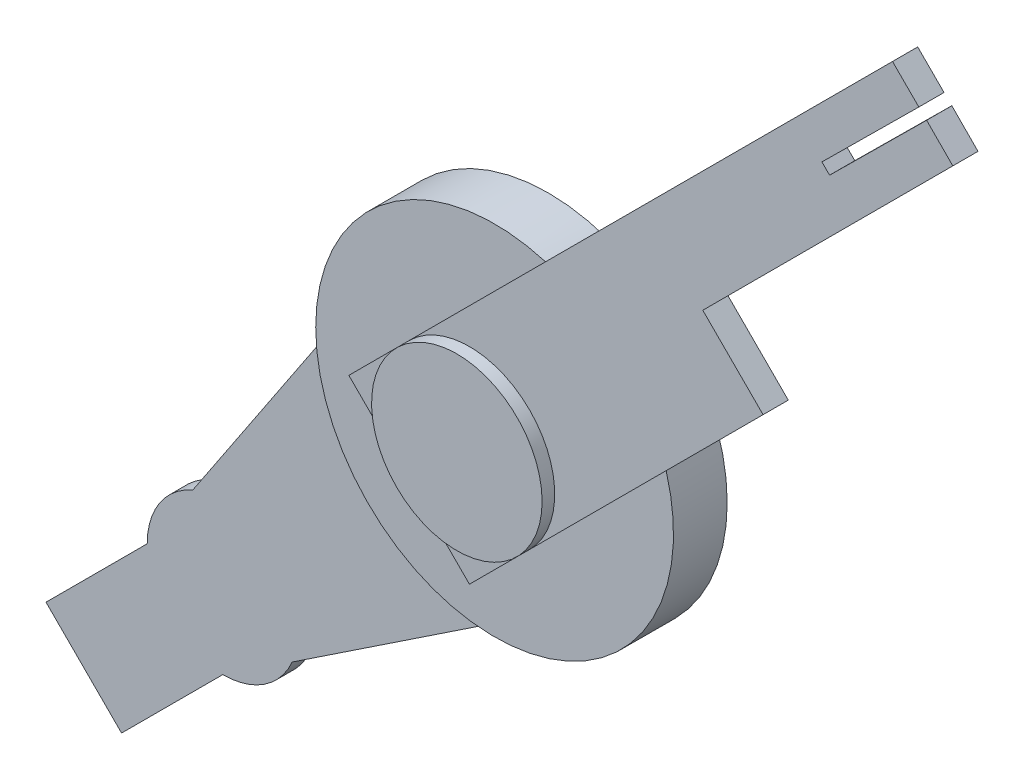
from build123d import *

# Parameters (mm, degrees)
BOSS_EXTRUDE1_DEPTH = 0.79375
SKETCH3_R           = 7.9375
BOSS_EXTRUDE2_DEPTH = 1.5875
BOSS_EXTRUDE3_DEPTH = 1.1176
SKETCH5_R           = 3.7830125
BOSS_EXTRUDE4_DEPTH = 0.5588
SKETCH7_R           = 1.905
BOSS_EXTRUDE5_DEPTH = 1.5875


with BuildPart() as part:
    # Sketch2 → Boss-Extrude1 (new body)
    with BuildSketch(Plane.XY):
        with BuildLine():
            Line((-10.570159202, -14.977509548), (0, -7.9375))
            ThreePointArc((0, -7.9375), (5.612660076, 5.612660076), (-7.9375, 0))
            Line((-7.9375, 0), (-14.977509548, -10.570159202))
            ThreePointArc((-14.977509548, -10.570159202), (-16.449796179, -11.80639255), (-17.00096249, -13.64816249))
            Line((-17.00096249, -13.64816249), (-21.49109055, -18.13829055))
            Line((-21.49109055, -18.13829055), (-18.13829055, -21.49109055))
            Line((-18.13829055, -21.49109055), (-13.64816249, -17.00096249))
            ThreePointArc((-13.64816249, -17.00096249), (-11.80639255, -16.449796179), (-10.570159202, -14.977509548))
        make_face()
    extrude(amount=BOSS_EXTRUDE1_DEPTH)

    # Sketch3 → Boss-Extrude2 (add)
    with BuildSketch(Plane.XY.offset(0.79375)):
        with Locations(Location((0, 0, 0), (0, 0, 180))):
            Circle(SKETCH3_R)
    extrude(amount=BOSS_EXTRUDE2_DEPTH)

    # Sketch4 → Boss-Extrude3 (add)
    with BuildSketch(Plane.XY.offset(2.38125)):
        Polygon((-5.349987584, 0), (0, -5.349987584), (13.027765396, 7.677777811), (10.352771604, 10.352771604), (21.444773795, 21.444773795), (20.283005592, 22.617844825), (15.977877039, 18.354197239), (15.63941792, 18.695949223), (19.937213299, 22.952334291), (18.769780003, 24.119767587), align=None)
    extrude(amount=BOSS_EXTRUDE3_DEPTH)

    # Sketch5 → Boss-Extrude4 (add)
    with BuildSketch(Plane.XY.offset(3.49885)):
        with Locations(Location((0, 0, 0), (0, 0, 225))):
            Circle(SKETCH5_R)
    extrude(amount=BOSS_EXTRUDE4_DEPTH)

    # Sketch7 → Boss-Extrude5 (add)
    with BuildSketch(Plane(origin=(0, 0, 0), x_dir=(-1, 0, 0), z_dir=(0, 0, -1))):
        with Locations(Location((0, 0, 0), (0, 0, 180))):
            Circle(SKETCH7_R)
    extrude(amount=BOSS_EXTRUDE5_DEPTH)


solid = part.part
